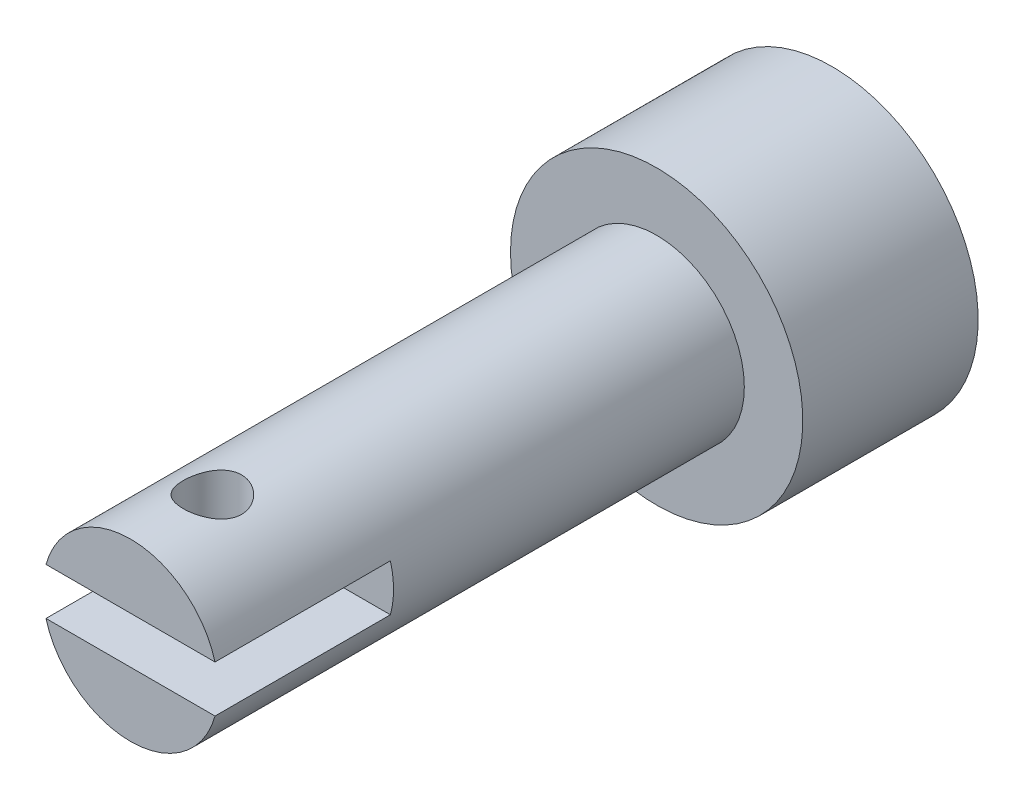
from build123d import *

# Parameters (mm, degrees)
SKETCH1_R           = 7.5
BOSS_EXTRUDE1_DEPTH = 30
SKETCH2_W           = 20
SKETCH2_H           = 4
CUT_EXTRUDE1_DEPTH  = 15
SKETCH3_R           = 2.5
CUT_EXTRUDE2_DEPTH  = 7.5
SKETCH4_R           = 12.5
BOSS_EXTRUDE2_DEPTH = 15


with BuildPart() as part:
    # Sketch1 → Boss-Extrude1 (new, symmetric)
    with BuildSketch(Plane.XY):
        Circle(SKETCH1_R)
    extrude(amount=BOSS_EXTRUDE1_DEPTH, both=True)

    # Sketch2 → Cut-Extrude1 (cut)
    with BuildSketch(Plane.XY.offset(30)):
        Rectangle(SKETCH2_W, SKETCH2_H)
    extrude(amount=-CUT_EXTRUDE1_DEPTH, mode=Mode.SUBTRACT)

    # Sketch3 → Cut-Extrude2 (cut, symmetric)
    with BuildSketch(Plane(origin=(0, 0, 0), x_dir=(1, 0, 0), z_dir=(0, 1, 0))):
        with Locations(Location((0, -23, 0), (0, 0, 270))):
            Circle(SKETCH3_R)
    extrude(amount=CUT_EXTRUDE2_DEPTH, both=True, mode=Mode.SUBTRACT)

    # Sketch4 → Boss-Extrude2 (add)
    with BuildSketch(Plane(origin=(0, 0, -30), x_dir=(-1, 0, 0), z_dir=(0, 0, -1))):
        Circle(SKETCH4_R)
    extrude(amount=-BOSS_EXTRUDE2_DEPTH)


solid = part.part
